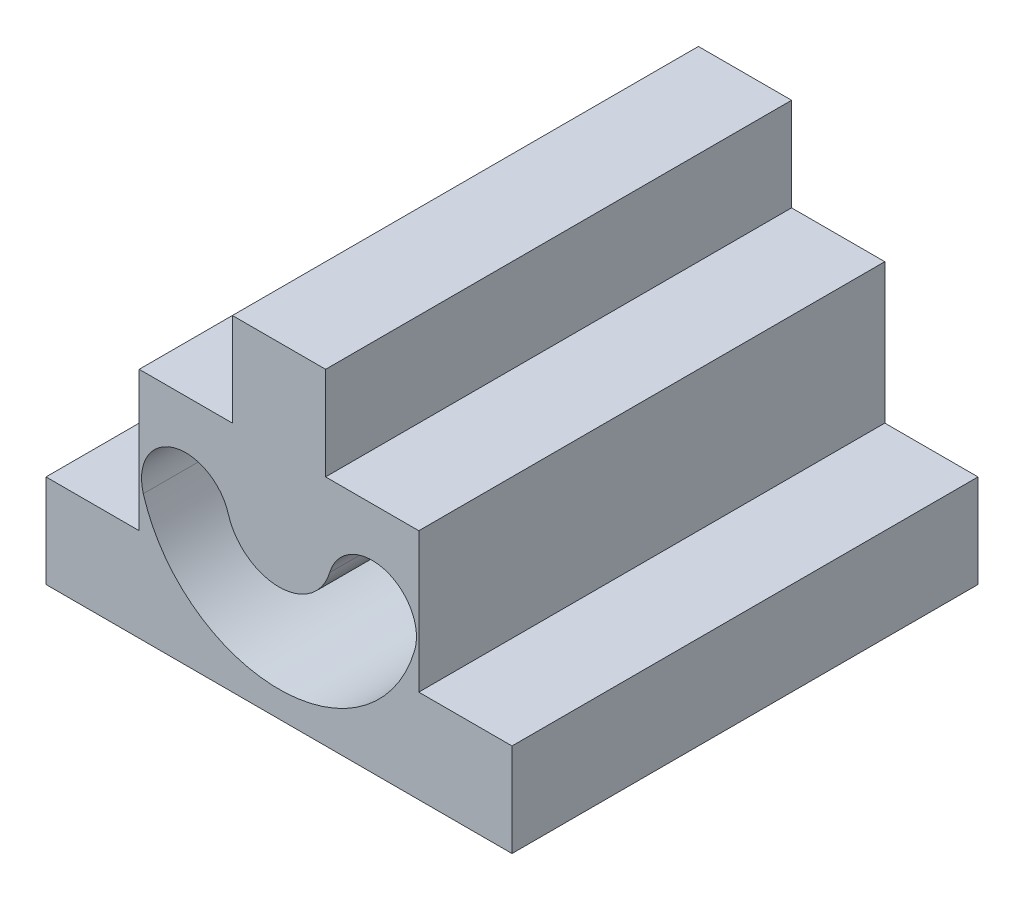
from build123d import *

# Parameters (mm, degrees)
BOSS_EXTRUDE1_DEPTH = 5
CUT_EXTRUDE1_DEPTH  = 10


with BuildPart() as part:
    # Sketch1 → Boss-Extrude1 (new, symmetric)
    with BuildSketch(Plane.XY):
        Polygon((-5, 0), (5, 0), (5, 2), (3, 2), (3, 5), (1, 5), (1, 7), (-1, 7), (-1, 5), (-3, 5), (-3, 2), (-5, 2), align=None)
    extrude(amount=BOSS_EXTRUDE1_DEPTH, both=True)

    # Sketch2 → Cut-Extrude1 (cut)
    with BuildSketch(Plane.XY.offset(5)):
        with BuildLine():
            ThreePointArc((-2.911371351, 2.73185403), (0, 0.553674644), (2.911371351, 2.73185403))
            ThreePointArc((2.911371351, 2.73185403), (2.26814597, 3.911371351), (1.088628649, 3.26814597))
            ThreePointArc((1.088628649, 3.26814597), (0, 2.453674644), (-1.088628649, 3.26814597))
            ThreePointArc((-1.088628649, 3.26814597), (-2.26814597, 3.911371351), (-2.911371351, 2.73185403))
        make_face()
    extrude(amount=-CUT_EXTRUDE1_DEPTH, mode=Mode.SUBTRACT)


solid = part.part
